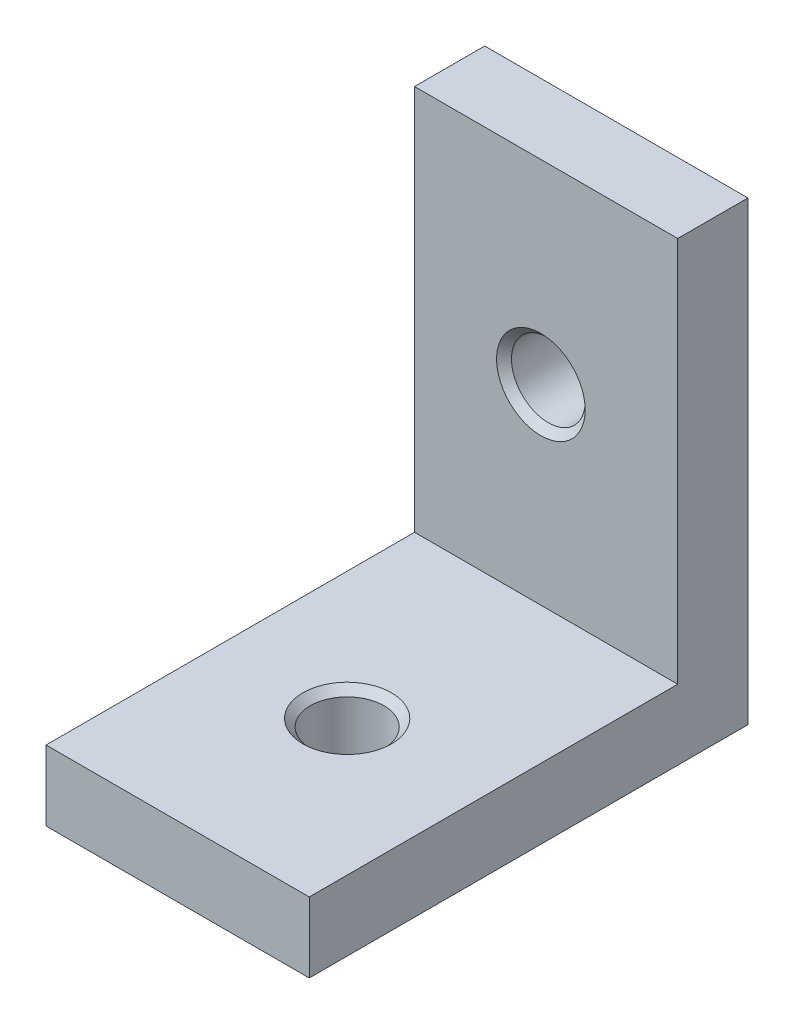
from build123d import *

# Parameters (mm, degrees)
SKETCH1_W                                 = 15
SKETCH1_H                                 = 25
BOSS_EXTRUDE1_DEPTH                       = 4
SKETCH2_W                                 = 15
SKETCH2_H                                 = 4
BOSS_EXTRUDE2_DEPTH                       = 22
M5X0_8_TAPPED_HOLE2_D                     = 4.2
M5X0_8_TAPPED_HOLE2_CSINK_D               = 5.05
M5X0_8_TAPPED_HOLE2_CSINK_ANGLE           = 90
M5X0_8_TAPPED_HOLE2_ON_FACE_2_D           = 4.2
M5X0_8_TAPPED_HOLE2_ON_FACE_2_CSINK_D     = 5.05
M5X0_8_TAPPED_HOLE2_ON_FACE_2_CSINK_ANGLE = 90


with BuildPart() as part:
    # Sketch1 → Boss-Extrude1 (new body)
    with BuildSketch(Plane(origin=(0, 0, 0), x_dir=(1, 0, 0), z_dir=(0, 1, 0))):
        with Locations((-22.468152866, 0.119426752)):
            Rectangle(SKETCH1_W, SKETCH1_H)
    extrude(amount=BOSS_EXTRUDE1_DEPTH)

    # Sketch2 → Boss-Extrude2 (add)
    with BuildSketch(Plane(origin=(0, 4, 0), x_dir=(1, 0, 0), z_dir=(0, 1, 0))):
        with Locations((-22.468152866, 10.619426752)):
            Rectangle(SKETCH2_W, SKETCH2_H)
    extrude(amount=BOSS_EXTRUDE2_DEPTH)

    # M5x0.8 Tapped Hole2 (through all)
    with Locations(Plane(origin=(-22.703417576, 4, 2.485289676), x_dir=(0, 0, 1), z_dir=(0, 1, 0))):
        with Locations((0, 0)):
            CounterSinkHole(M5X0_8_TAPPED_HOLE2_D / 2, M5X0_8_TAPPED_HOLE2_CSINK_D / 2, counter_sink_angle=M5X0_8_TAPPED_HOLE2_CSINK_ANGLE)

    # M5x0.8 Tapped Hole2 on face 2 (through all)
    with Locations(Plane(origin=(-22.76831123, 14.89235582, -8.619426752), x_dir=(1, 0, 0), z_dir=(0, 0, 1))):
        with Locations((0, 0)):
            CounterSinkHole(M5X0_8_TAPPED_HOLE2_ON_FACE_2_D / 2, M5X0_8_TAPPED_HOLE2_ON_FACE_2_CSINK_D / 2, counter_sink_angle=M5X0_8_TAPPED_HOLE2_ON_FACE_2_CSINK_ANGLE)


solid = part.part
